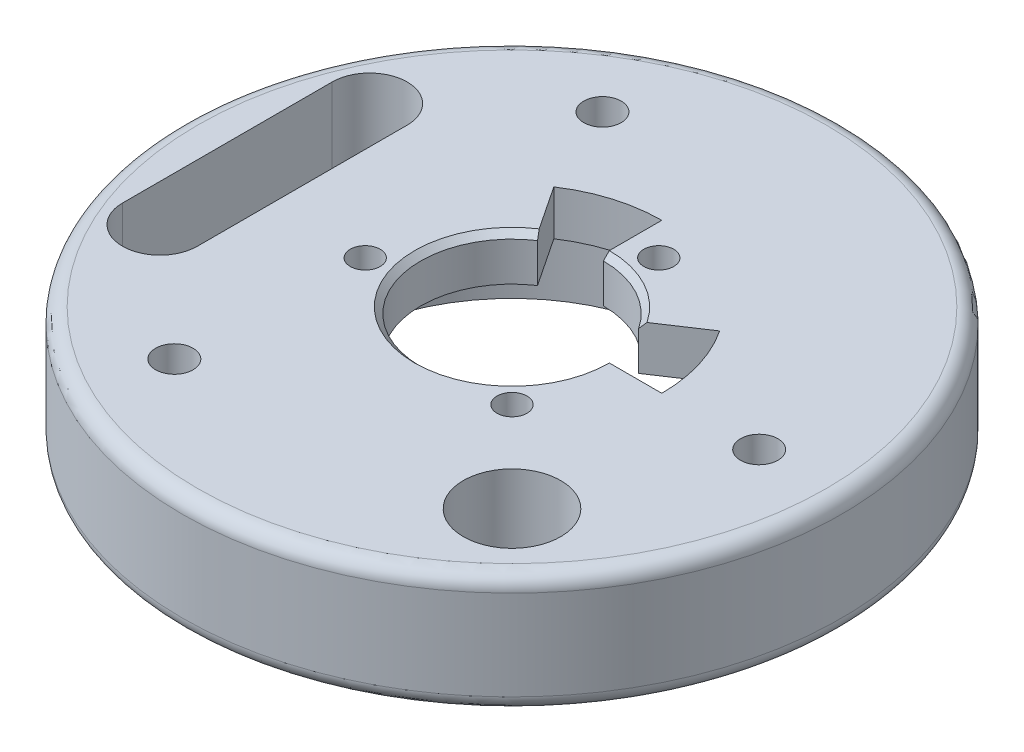
from build123d import *

# Parameters (mm, degrees)
FILLET2_R          = 1
CHAMFER2_SIZE      = 0.4
SKETCH3_R          = 1
SKETCH3_R_2        = 1.25
SKETCH3_R_3        = 3.25
CUT_EXTRUDE1_DEPTH = 10


with BuildPart() as part:
    # Sketch1 → Revolve1 (revolve)
    with BuildSketch(Plane.XY, mode=Mode.PRIVATE) as revolve1_sk:
        Polygon((12, 0), (12, 4), (13, 4), (13, 5), (6.1, 5), (6.1, 8), (22, 8), (22, 0), align=None)
    revolve(revolve1_sk.sketch.rotate(Axis((0, 0, 0), (0, 1, 0)), 90), axis=Axis((0, 0, 0), (0, 1, 0)))

    # Fillet2
    fillet2_edges = [part.edges().sort_by_distance(p)[0] for p in [
        (0, 8, 22),
        (0, 0, 22),
    ]]
    fillet(fillet2_edges, radius=FILLET2_R)

    # Chamfer2
    chamfer2_edges = [part.edges().sort_by_distance(p)[0] for p in [
        (0, 8, 6.1),
    ]]
    chamfer(chamfer2_edges, length=CHAMFER2_SIZE)

    # Sketch3 → Cut-Extrude1 (cut)
    with BuildSketch(Plane(origin=(0, 8, 0), x_dir=(1, 0, 0), z_dir=(0, 1, 0))):
        with Locations(Location((2.070552361, 7.72740661, 0), (0, 0, 270))):
            Circle(SKETCH3_R)
        with Locations(Location((5.656854249, -5.656854249, 0), (0, 0, 270))):
            Circle(SKETCH3_R)
        with Locations(Location((-7.72740661, -2.070552361, 0), (0, 0, 270))):
            Circle(SKETCH3_R)
        with Locations(Location((16.5, 0, 0), (0, 0, 270))):
            Circle(SKETCH3_R_2)
        with Locations(Location((-8.25, -14.289419162, 0), (0, 0, 270))):
            Circle(SKETCH3_R_2)
        with Locations(Location((-8.25, 14.289419162, 0), (0, 0, 270))):
            Circle(SKETCH3_R_2)
        with Locations(Location((11.66726189, -11.66726189, 0), (0, 0, 270))):
            Circle(SKETCH3_R_3)
        with BuildLine():
            Line((0, 0), (8.327920422, 5.535859594))
            ThreePointArc((8.327920422, 5.535859594), (9.572857573, 2.891435264), (10, 0))
            Line((10, 0), (0, 0))
        make_face()
        with BuildLine():
            Line((-19, 7), (-19, -7))
            ThreePointArc((-19, -7), (-16.5, -9.5), (-14, -7))
            Line((-14, -7), (-14, 7))
            ThreePointArc((-14, 7), (-16.5, 9.5), (-19, 7))
        make_face()
        with BuildLine():
            Line((-5.535859594, 8.327920422), (-3.064574144, 4.610219816))
            ThreePointArc((-3.064574144, 4.610219816), (-1.600657965, 5.299399543), (0, 5.535859594))
            Line((0, 5.535859594), (0, 10))
            ThreePointArc((0, 10), (-2.891435264, 9.572857573), (-5.535859594, 8.327920422))
        make_face()
    extrude(amount=-CUT_EXTRUDE1_DEPTH, mode=Mode.SUBTRACT)


solid = part.part
